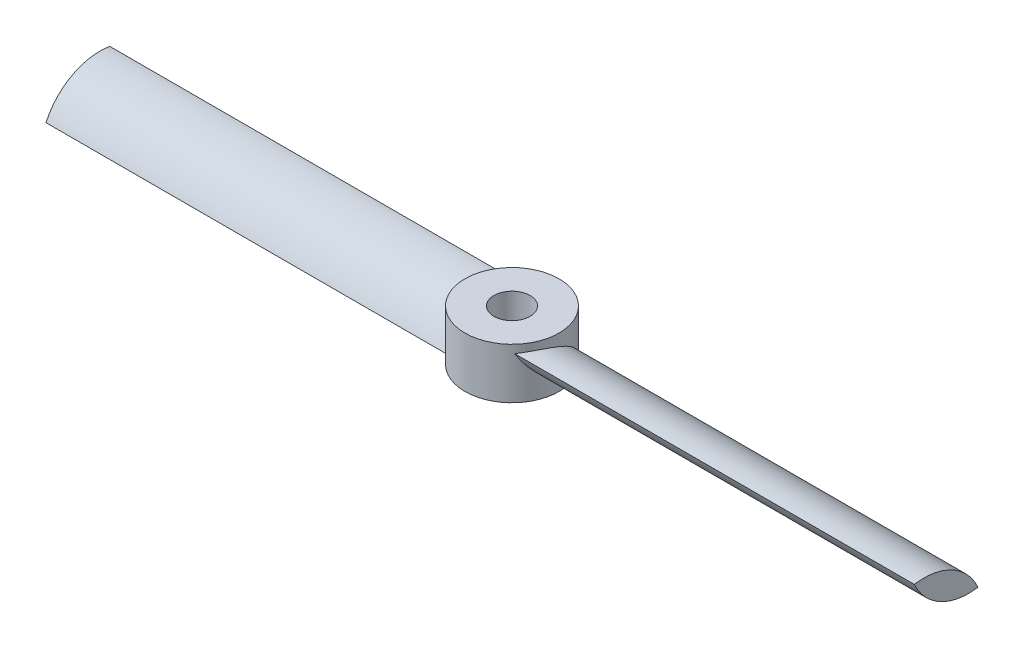
from build123d import *

# Parameters (mm, degrees)
SKETCH1_R           = 6.5
SKETCH1_R_2         = 2.5
BOSS_EXTRUDE1_DEPTH = 7
BOSS_EXTRUDE2_START = 4
BOSS_EXTRUDE2_DEPTH = 56
CIRPATTERN1_COUNT   = 2


with BuildPart() as part:
    # Sketch1 → Boss-Extrude1 (new body)
    with BuildSketch(Plane(origin=(0, 0, 0), x_dir=(1, 0, 0), z_dir=(0, 1, 0))):
        with Locations(Location((0, 0, 0), (0, 0, 270))):
            Circle(SKETCH1_R)
        with Locations(Location((0, 0, 0), (0, 0, 270))):
            Circle(SKETCH1_R_2, mode=Mode.SUBTRACT)
    extrude(amount=BOSS_EXTRUDE1_DEPTH)

    # Sketch2 → Boss-Extrude2 (add)
    with BuildSketch(Plane(origin=(0, 0, 0), x_dir=(0, 0, -1), z_dir=(1, 0, 0)).offset(BOSS_EXTRUDE2_START)):
        with BuildLine():
            ThreePointArc((-4.4023555, 5.870499115), (0.805969699, 4.99680087), (4.4023555, 1.129500885))
            Line((4.4023555, 1.129500885), (-4.4023555, 5.870499115))
        make_face()
        with BuildLine():
            Line((-4.4023555, 5.870499115), (4.4023555, 1.129500885))
            ThreePointArc((4.4023555, 1.129500885), (-0.805969699, 2.00319913), (-4.4023555, 5.870499115))
        make_face()
    boss_extrude2 = extrude(amount=BOSS_EXTRUDE2_DEPTH)

    # CirPattern1: Boss-Extrude2 ×2 about axis
    cirpattern1_axis = Axis((0, 7.76683161, 0), (0, -1, 0))
    for i in range(1, CIRPATTERN1_COUNT):
        add(boss_extrude2.rotate(cirpattern1_axis, i * 360 / CIRPATTERN1_COUNT))


solid = part.part
